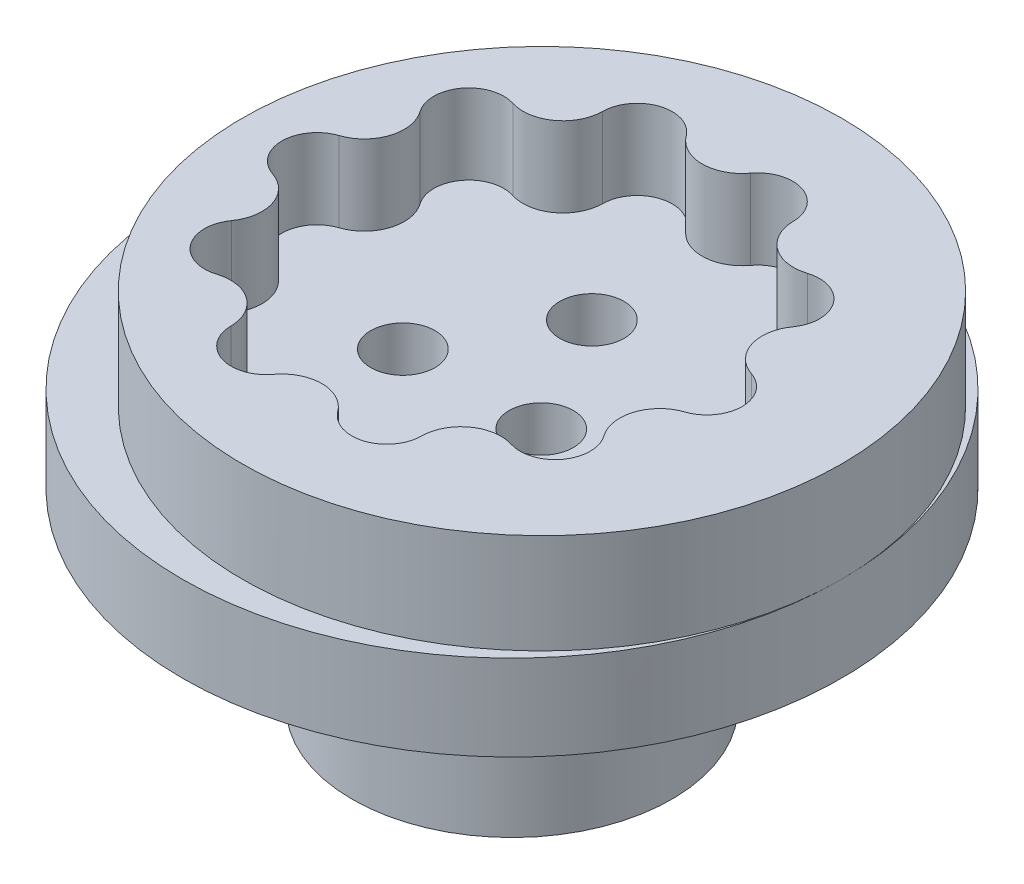
from build123d import *

# Parameters (mm, degrees)
SKETCH1_R               = 26.19375
BOSS_EXTRUDE1_DEPTH     = 8.397875
SKETCH2_R               = 12.7
BOSS_EXTRUDE2_DEPTH     = 15.08125
BOSS_EXTRUDE3_START     = 6.35
SKETCH3_R               = 26.19375
BOSS_EXTRUDE3_DEPTH     = 6.35
F_1_4_20_TAPPED_HOLE1_D = 5.1054
SKETCH6_W               = 66.50359939
SKETCH6_H               = 67.616646228
CUT_EXTRUDE2_DEPTH      = 7.9375


with BuildPart() as part:
    # Sketch1 → Boss-Extrude1 (new body)
    with BuildSketch(Plane(origin=(0, 0, 0), x_dir=(1, 0, 0), z_dir=(0, 1, 0))):
        with Locations(Location((0, 0, 0), (0, 0, 270))):
            Circle(SKETCH1_R)
    extrude(amount=-BOSS_EXTRUDE1_DEPTH)

    # Sketch2 → Boss-Extrude2 (add)
    with BuildSketch(Plane.XZ.offset(8.397875)):
        with Locations(Location((0, 0, 0), (0, 0, 90))):
            Circle(SKETCH2_R)
    extrude(amount=BOSS_EXTRUDE2_DEPTH)

    # Sketch3 → Boss-Extrude3 (add)
    with BuildSketch(Plane(origin=(0, 0, 0), x_dir=(1, 0, 0), z_dir=(0, 1, 0)).offset(BOSS_EXTRUDE3_START)):
        with Locations(Location((0, 0, 0), (0, 0, 270))):
            Circle(SKETCH3_R)
        with BuildLine():
            ThreePointArc((2.553003524, 16.40046245), (5.651302793, 17.39292157), (7.574526721, 14.768870658))
            ThreePointArc((7.574526721, 14.768870658), (7.926495509, 13.34211974), (8.883198518, 12.226673836))
            ThreePointArc((8.883198518, 12.226673836), (10.239688102, 11.661486946), (11.705373197, 11.767635017))
            ThreePointArc((11.705373197, 11.767635017), (14.795302793, 10.749416694), (14.808845207, 7.496072251))
            ThreePointArc((14.808845207, 7.496072251), (14.25497079, 6.134924448), (14.373317131, 4.670173836))
            ThreePointArc((14.373317131, 4.670173836), (15.138531738, 3.415603465), (16.386688159, 2.639970974))
            ThreePointArc((16.386688159, 2.639970974), (18.288, 0), (16.386688159, -2.639970974))
            ThreePointArc((16.386688159, -2.639970974), (15.138531738, -3.415603465), (14.373317131, -4.670173836))
            ThreePointArc((14.373317131, -4.670173836), (14.25497079, -6.134924448), (14.808845207, -7.496072251))
            ThreePointArc((14.808845207, -7.496072251), (14.795302793, -10.749416694), (11.705373197, -11.767635017))
            ThreePointArc((11.705373197, -11.767635017), (10.239688102, -11.661486946), (8.883198518, -12.226673836))
            ThreePointArc((8.883198518, -12.226673836), (7.926495509, -13.34211974), (7.574526721, -14.768870658))
            ThreePointArc((7.574526721, -14.768870658), (5.651302793, -17.39292157), (2.553003524, -16.40046245))
            ThreePointArc((2.553003524, -16.40046245), (1.429631644, -15.453078773), (0, -15.113))
            ThreePointArc((0, -15.113), (-1.429631644, -15.453078773), (-2.553003524, -16.40046245))
            ThreePointArc((-2.553003524, -16.40046245), (-5.651302793, -17.39292157), (-7.574526721, -14.768870658))
            ThreePointArc((-7.574526721, -14.768870658), (-7.926495509, -13.34211974), (-8.883198518, -12.226673836))
            ThreePointArc((-8.883198518, -12.226673836), (-10.239688102, -11.661486946), (-11.705373197, -11.767635017))
            ThreePointArc((-11.705373197, -11.767635017), (-14.795302793, -10.749416694), (-14.808845207, -7.496072251))
            ThreePointArc((-14.808845207, -7.496072251), (-14.25497079, -6.134924448), (-14.373317131, -4.670173836))
            ThreePointArc((-14.373317131, -4.670173836), (-15.138531738, -3.415603465), (-16.386688159, -2.639970974))
            ThreePointArc((-16.386688159, -2.639970974), (-18.288, 0), (-16.386688159, 2.639970974))
            ThreePointArc((-16.386688159, 2.639970974), (-15.138531738, 3.415603465), (-14.373317131, 4.670173836))
            ThreePointArc((-14.373317131, 4.670173836), (-14.25497079, 6.134924448), (-14.808845207, 7.496072251))
            ThreePointArc((-14.808845207, 7.496072251), (-14.795302793, 10.749416694), (-11.705373197, 11.767635017))
            ThreePointArc((-11.705373197, 11.767635017), (-10.239688102, 11.661486946), (-8.883198518, 12.226673836))
            ThreePointArc((-8.883198518, 12.226673836), (-7.926495509, 13.34211974), (-7.574526721, 14.768870658))
            ThreePointArc((-7.574526721, 14.768870658), (-5.651302793, 17.39292157), (-2.553003524, 16.40046245))
            ThreePointArc((-2.553003524, 16.40046245), (-1.429631644, 15.453078773), (0, 15.113))
            ThreePointArc((0, 15.113), (1.429631644, 15.453078773), (2.553003524, 16.40046245))
        make_face(mode=Mode.SUBTRACT)
    extrude(amount=-BOSS_EXTRUDE3_DEPTH)

    # 1/4-20 Tapped Hole1 (through all)
    with Locations(Plane(origin=(0, -23.479125, 0), x_dir=(-1, 0, 0), z_dir=(0, -1, 0))):
        with Locations((0, 6.35), (5.499261314, -3.175), (-5.499261314, -3.175)):
            Hole(F_1_4_20_TAPPED_HOLE1_D / 2)

    # Sketch6 → Cut-Extrude2 (cut)
    with BuildSketch(Plane(origin=(0, 6.35, 0), x_dir=(1, 0, 0), z_dir=(0, 1, 0))):
        Rectangle(SKETCH6_W, SKETCH6_H)
        with BuildLine():
            ThreePointArc((26.19375, 0), (2.38125, -23.8125), (-21.43125, 0))
            ThreePointArc((-21.43125, 0), (2.38125, 23.8125), (26.19375, 0))
        make_face(mode=Mode.SUBTRACT)
    extrude(amount=-CUT_EXTRUDE2_DEPTH, mode=Mode.SUBTRACT)


solid = part.part
